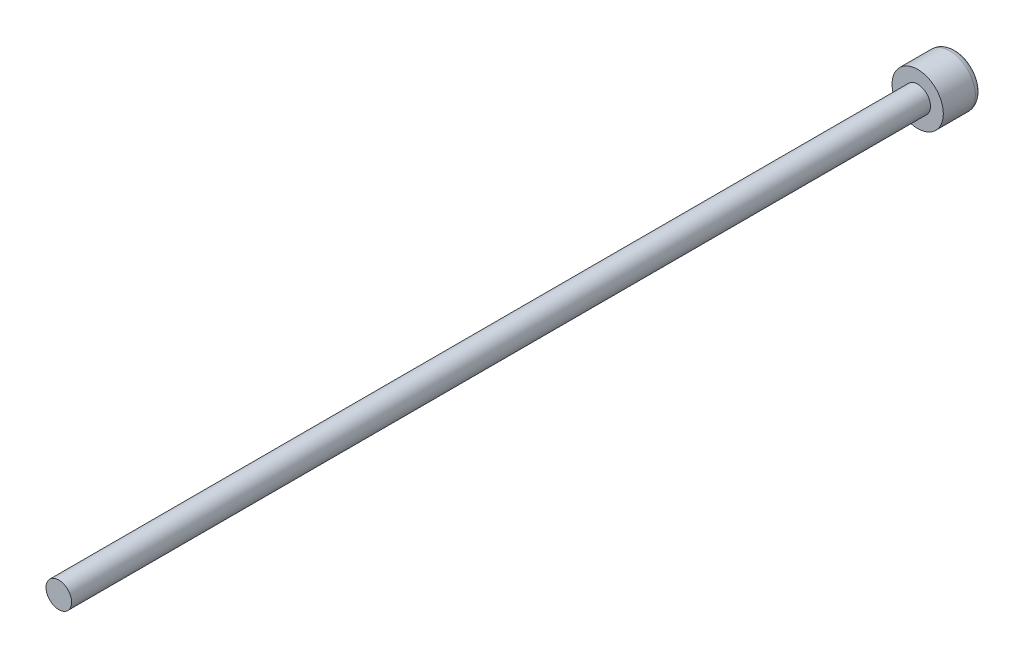
from build123d import *

# Parameters (mm, degrees)
SKETCH1_R           = 1
BOSS_EXTRUDE1_DEPTH = 70
SKETCH2_R           = 2
BOSS_EXTRUDE2_DEPTH = 3
FILLET1_R           = 0.5


with BuildPart() as part:
    # Sketch1 → Boss-Extrude1 (new body)
    with BuildSketch(Plane.XY):
        Circle(SKETCH1_R)
    extrude(amount=BOSS_EXTRUDE1_DEPTH)

    # Sketch2 → Boss-Extrude2 (add)
    with BuildSketch(Plane.XY):
        Circle(SKETCH2_R)
    extrude(amount=BOSS_EXTRUDE2_DEPTH)

    # Fillet1
    fillet1_edges = [part.edges().sort_by_distance(p)[0] for p in [
        (-2, 0, 0),
    ]]
    fillet(fillet1_edges, radius=FILLET1_R)


solid = part.part
